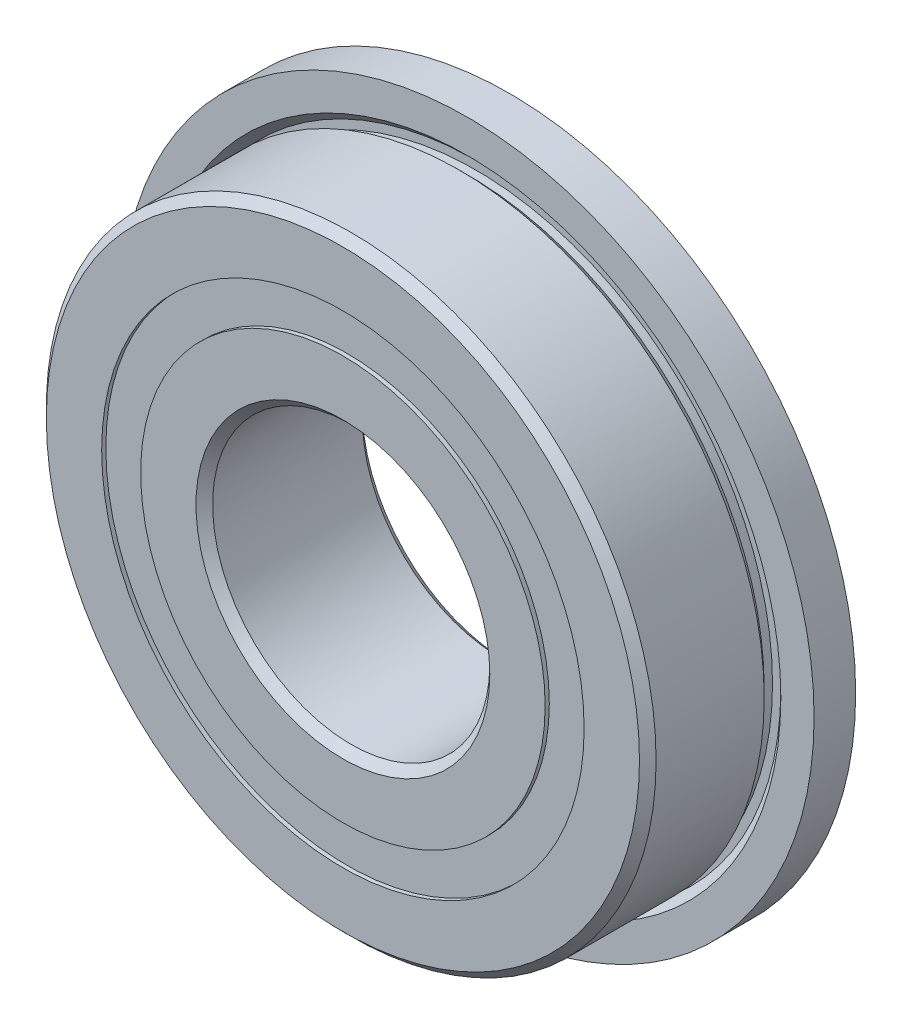
from build123d import *

# Parameters (mm, degrees)
SKETCH6_W = 0.234432234
SKETCH6_H = 0.703296704
SKETCH5_W = 1.342550488
SKETCH5_H = 1.406593406


with BuildPart() as part:
    # Sketch7 → Revolve7 (revolve)
    with BuildSketch(Plane(origin=(0, 0, 0), x_dir=(0, 0, -1), z_dir=(1, 0, 0))):
        with BuildLine():
            Line((3, 12.5), (1.5, 12.5))
            Line((1.5, 12.5), (1.5, 11.3))
            Line((1.5, 11.3), (1.8, 11))
            Line((1.8, 11), (1.8, 10.7))
            Line((1.8, 10.7), (1.5, 10.7))
            Line((1.5, 10.7), (1.2, 11))
            Line((1.2, 11), (-2.7, 11))
            Line((-2.7, 11), (-3, 10.7))
            Line((-3, 10.7), (-3, 8.703296703))
            Line((-3, 8.703296703), (-1.333333333, 8.703296703))
            ThreePointArc((-1.333333333, 8.703296703), (0, 9.507449512), (1.333333333, 8.703296703))
            Line((1.333333333, 8.703296703), (3, 8.703296703))
            Line((3, 8.703296703), (3, 10.7))
            Line((3, 10.7), (3, 12.5))
        make_face()
    revolve(axis=Axis((0, 0, 3), (0, 0, -1)))


with BuildPart() as body_2:
    # Sketch3 → Revolve3 (revolve)
    with BuildSketch(Plane(origin=(0, 0, 0), x_dir=(0, 0, -1), z_dir=(1, 0, 0))):
        with BuildLine():
            Line((-3, 7.296703297), (-1.333333333, 7.296703297))
            ThreePointArc((-1.333333333, 7.296703297), (0, 6.492550488), (1.333333333, 7.296703297))
            Line((1.333333333, 7.296703297), (3, 7.296703297))
            Line((3, 7.296703297), (3, 5.3))
            Line((3, 5.3), (2.7, 5))
            Line((2.7, 5), (-2.7, 5))
            Line((-2.7, 5), (-3, 5.3))
            Line((-3, 5.3), (-3, 7.296703297))
        make_face()
    revolve(axis=Axis((0, 0, 3), (0, 0, -1)))


with BuildPart() as body_3:
    # Sketch6 → Revolve6 (revolve)
    with BuildSketch(Plane(origin=(0, 0, 0), x_dir=(0, 0, -1), z_dir=(1, 0, 0))):
        with Locations((0, 8)):
            Rectangle(SKETCH6_W, SKETCH6_H)
    revolve(axis=Axis((0, 0, 3), (0, 0, -1)))


with BuildPart() as body_4:
    # Sketch4 → Revolve4 (revolve)
    with BuildSketch(Plane(origin=(0, 0, 0), x_dir=(0, 0, -1), z_dir=(1, 0, 0))):
        with BuildLine():
            Line((-1.507449512, 8), (1.507449512, 8))
            ThreePointArc((1.507449512, 8), (0, 9.507449512), (-1.507449512, 8))
        make_face()
    revolve(axis=Axis((0, 8, 1.507449512), (0, 0, -1)))


with BuildPart() as body_5:
    # Sketch5 → Revolve5 (revolve)
    with BuildSketch(Plane(origin=(0, 0, 0), x_dir=(0, 0, -1), z_dir=(1, 0, 0))):
        with Locations((-2.178724756, 8)):
            Rectangle(SKETCH5_W, SKETCH5_H)
        with Locations((2.178724756, 8)):
            Rectangle(SKETCH5_W, SKETCH5_H)
    revolve(axis=Axis((0, 0, 3), (0, 0, -1)))


solid = Compound([part.part, body_2.part, body_3.part, body_4.part, body_5.part])
